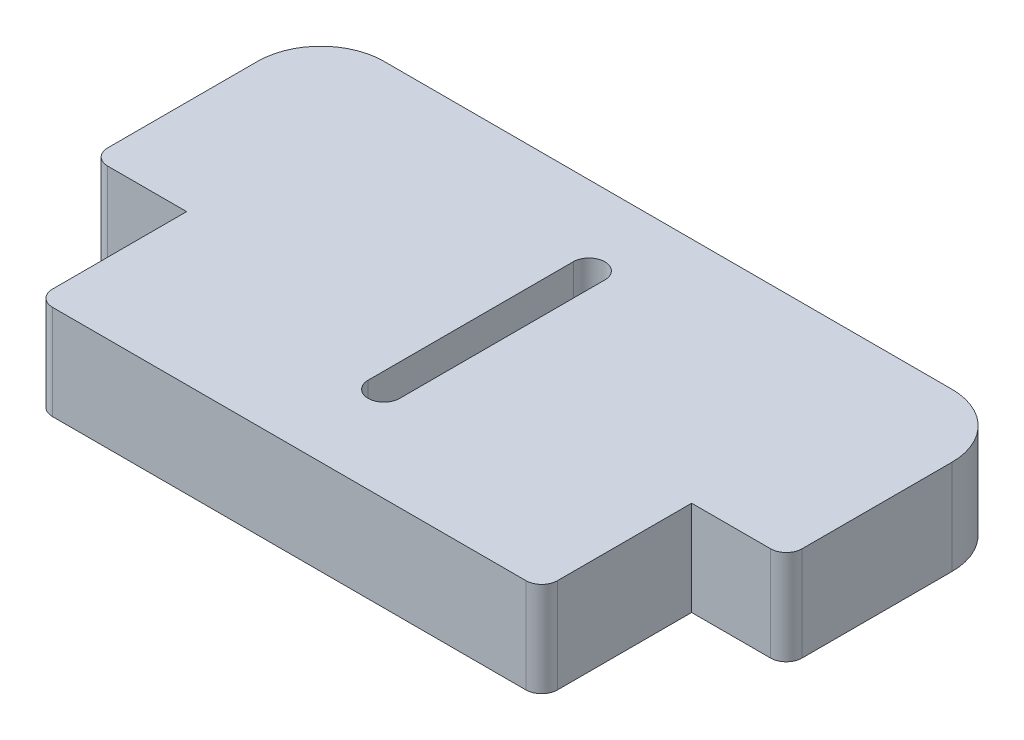
from build123d import *

# Parameters (mm, degrees)
BOSS_EXTRUDE1_DEPTH = 3
FILLET1_R           = 2
FILLET2_R           = 0.5


with BuildPart() as part:
    # Sketch1 → Boss-Extrude1 (new body)
    with BuildSketch(Plane(origin=(0, 0, 0), x_dir=(1, 0, 0), z_dir=(0, 1, 0))):
        Polygon((0.555255475, 90.8817274), (16.555255475, 90.8817274), (16.555255475, 95.6317274), (19.555255475, 95.6317274), (19.555255475, 102.8817274), (-2.444744525, 102.8817274), (-2.444744525, 95.6317274), (0.555255475, 95.6317274), align=None)
        with BuildLine():
            ThreePointArc((8.055255475, 100.3817274), (8.555255475, 100.8817274), (9.055255475, 100.3817274))
            Line((9.055255475, 100.3817274), (9.055255475, 93.8817274))
            ThreePointArc((9.055255475, 93.8817274), (8.555255475, 93.3817274), (8.055255475, 93.8817274))
            Line((8.055255475, 93.8817274), (8.055255475, 100.3817274))
        make_face(mode=Mode.SUBTRACT)
    extrude(amount=BOSS_EXTRUDE1_DEPTH)

    # Fillet1
    fillet1_edges = [part.edges().sort_by_distance(p)[0] for p in [
        (-2.444744525, 1.5, -102.8817274),
        (19.555255475, 1.5, -102.8817274),
    ]]
    fillet(fillet1_edges, radius=FILLET1_R)

    # Fillet2
    fillet2_edges = [part.edges().sort_by_distance(p)[0] for p in [
        (-2.444744525, 1.5, -95.6317274),
        (19.555255475, 1.5, -95.6317274),
        (16.555255475, 1.5, -90.8817274),
        (0.555255475, 1.5, -90.8817274),
    ]]
    fillet(fillet2_edges, radius=FILLET2_R)


solid = part.part
